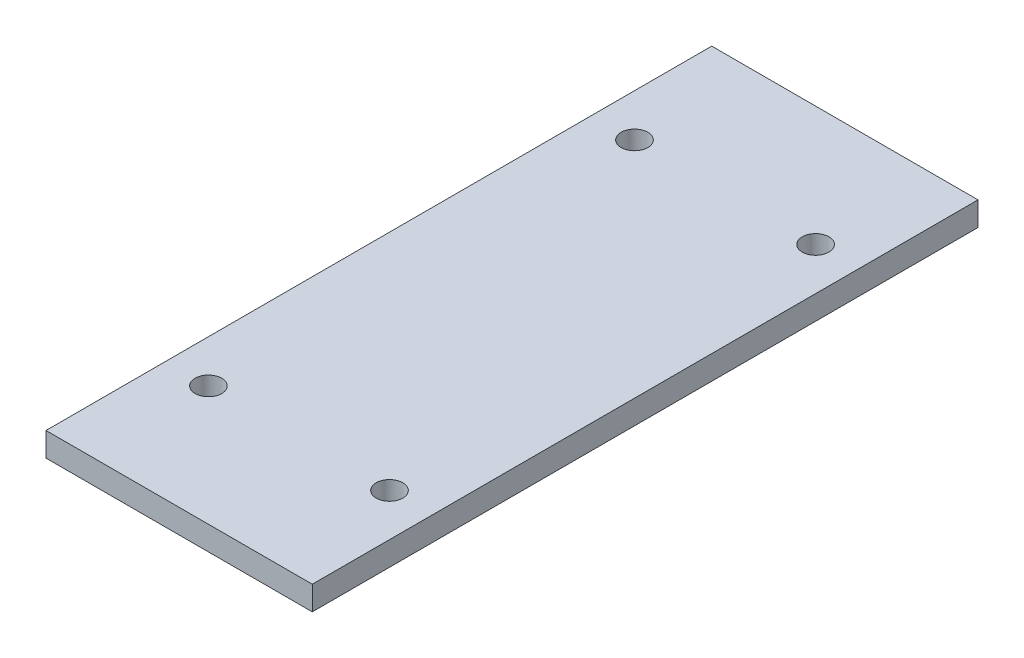
from build123d import *

# Parameters (mm, degrees)
SKETCH1_W           = 100
SKETCH1_H           = 9
BOSS_EXTRUDE1_DEPTH = 250
SKETCH2_R           = 5
CUT_EXTRUDE2_DEPTH  = 270.408611592


with BuildPart() as part:
    # Sketch1 → Boss-Extrude1 (new body)
    with BuildSketch(Plane.XY):
        with Locations((50, -4.5)):
            Rectangle(SKETCH1_W, SKETCH1_H)
    extrude(amount=BOSS_EXTRUDE1_DEPTH)

    # Sketch2 → Cut-Extrude2 (cut, through all)
    with BuildSketch(Plane(origin=(0, 0, 0), x_dir=(1, 0, 0), z_dir=(0, 1, 0))):
        with Locations(Location((16, -45, 0), (0, 0, 270))):
            Circle(SKETCH2_R)
        with Locations(Location((84, -45, 0), (0, 0, 270))):
            Circle(SKETCH2_R)
        with Locations(Location((16, -205, 0), (0, 0, 270))):
            Circle(SKETCH2_R)
        with Locations(Location((84, -205, 0), (0, 0, 270))):
            Circle(SKETCH2_R)
    extrude(amount=-CUT_EXTRUDE2_DEPTH, mode=Mode.SUBTRACT)


solid = part.part
